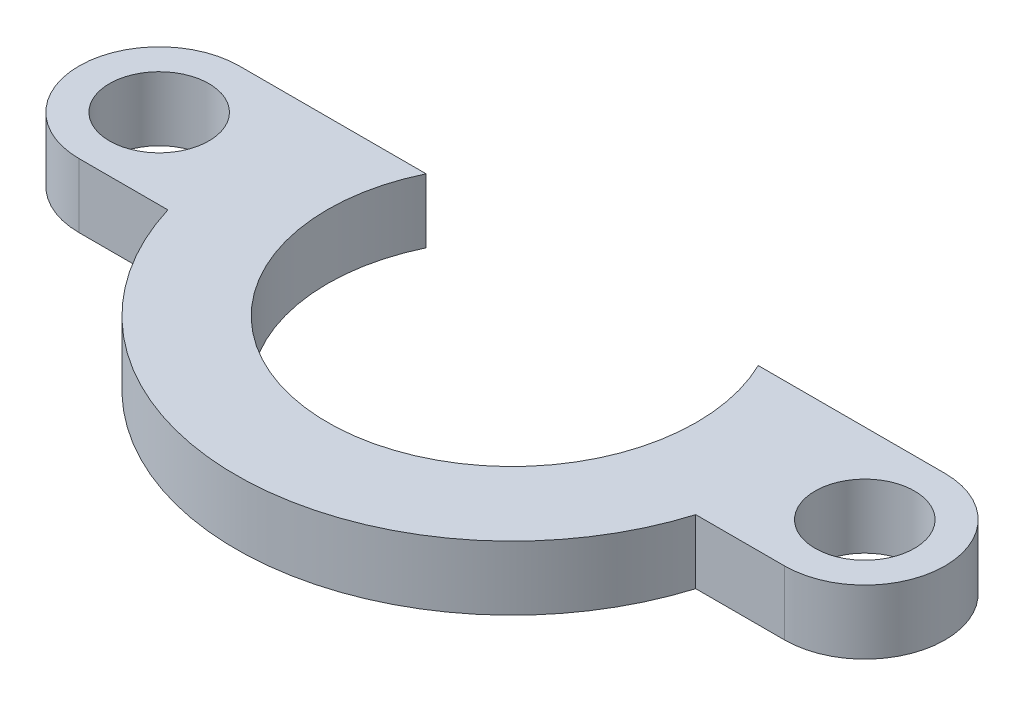
from build123d import *

# Parameters (mm, degrees)
SKETCH1_R           = 1.55
BOSS_EXTRUDE1_DEPTH = 2


with BuildPart() as part:
    # Sketch1 → Boss-Extrude1 (new body)
    with BuildSketch(Plane(origin=(0, 0, 0), x_dir=(1, 0, 0), z_dir=(0, 1, 0))):
        with BuildLine():
            Line((8.228608631, -2.5), (11, -2.5))
            ThreePointArc((11, -2.5), (13.5, 0), (11, 2.5))
            Line((11, 2.5), (5.178078794, 2.5))
            ThreePointArc((5.178078794, 2.5), (0, -5.75), (-5.178078794, 2.5))
            Line((-5.178078794, 2.5), (-11, 2.5))
            ThreePointArc((-11, 2.5), (-13.5, 0), (-11, -2.5))
            Line((-11, -2.5), (-8.228608631, -2.5))
            ThreePointArc((-8.228608631, -2.5), (0, -8.6), (8.228608631, -2.5))
        make_face()
        with Locations(Location((-11, 0, 0), (0, 0, 270))):
            Circle(SKETCH1_R, mode=Mode.SUBTRACT)
        with Locations(Location((11, 0, 0), (0, 0, 270))):
            Circle(SKETCH1_R, mode=Mode.SUBTRACT)
    extrude(amount=BOSS_EXTRUDE1_DEPTH)


solid = part.part
